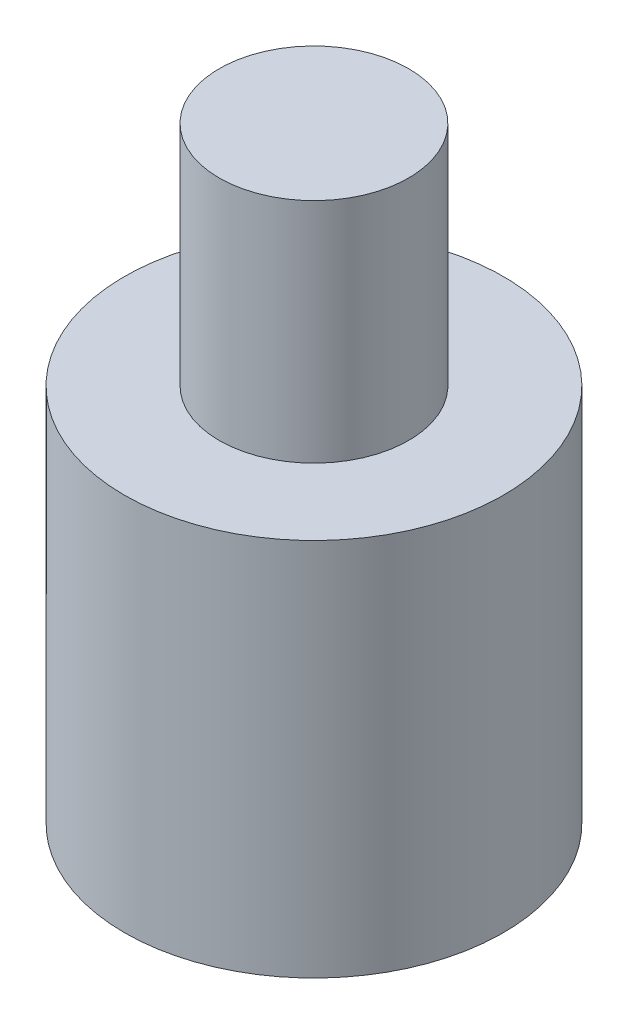
from build123d import *

# Parameters (mm, degrees)
SKETCH1_R           = 2.5
BOSS_EXTRUDE1_DEPTH = 5
SKETCH2_R           = 1.25
BOSS_EXTRUDE2_DEPTH = 3


with BuildPart() as part:
    # Sketch1 → Boss-Extrude1 (new body)
    with BuildSketch(Plane(origin=(0, 0, 0), x_dir=(1, 0, 0), z_dir=(0, 1, 0))):
        with Locations(Location((0, 0, 0), (0, 0, 270))):
            Circle(SKETCH1_R)
    extrude(amount=BOSS_EXTRUDE1_DEPTH)

    # Sketch2 → Boss-Extrude2 (add)
    with BuildSketch(Plane(origin=(0, 5, 0), x_dir=(1, 0, 0), z_dir=(0, 1, 0))):
        with Locations(Location((0, 0, 0), (0, 0, 270))):
            Circle(SKETCH2_R)
    extrude(amount=BOSS_EXTRUDE2_DEPTH)


solid = part.part
